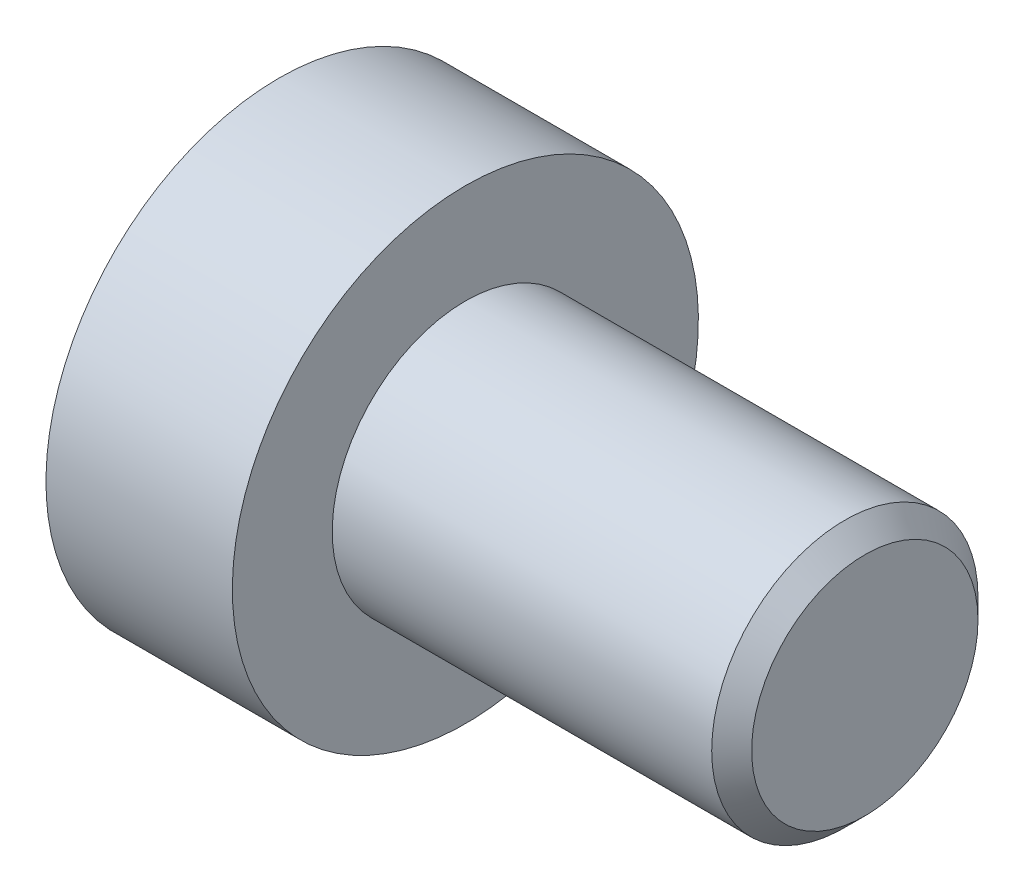
from build123d import *

# Parameters (mm, degrees)
SKETCH2_R           = 2
BOSS_EXTRUDE1_DEPTH = 6
CHAMFER1_SIZE       = 0.3
SKETCH6_W           = 2.8
SKETCH6_H           = 3.5
CUT_EXTRUDE1_DEPTH  = 1.6
SKETCH8_R           = 1.493375673
CUT_EXTRUDE2_DEPTH  = 1
CUT_EXTRUDE2_DRAFT  = -45


with BuildPart() as part:
    # Sketch2 → Boss-Extrude1 (new body)
    with BuildSketch(Plane(origin=(0, 0, 0), x_dir=(0, 0, -1), z_dir=(1, 0, 0))):
        Circle(SKETCH2_R)
    extrude(amount=-BOSS_EXTRUDE1_DEPTH)

    # Chamfer1
    chamfer1_edges = [part.edges().sort_by_distance(p)[0] for p in [
        (0, 0, 2),
    ]]
    chamfer(chamfer1_edges, length=CHAMFER1_SIZE)

    # Sketch6 → Revolve1 (revolve)
    with BuildSketch(Plane.XY):
        with Locations((-7.4, 1.75)):
            Rectangle(SKETCH6_W, SKETCH6_H)
    revolve(axis=Axis((-6, 0, 0), (-1, 0, 0)))

    # Sketch7 → Cut-Extrude1 (cut)
    with BuildSketch(Plane.ZY.offset(8.8)):
        Polygon((0, 1.443375673), (-1.25, 0.721687836), (-1.25, -0.721687836), (0, -1.443375673), (1.25, -0.721687836), (1.25, 0.721687836), align=None)
    extrude(amount=-CUT_EXTRUDE1_DEPTH, mode=Mode.SUBTRACT)


with BuildPart() as cut_extrude2_tool:
    # Sketch8 → Cut-Extrude2 (with draft: the straight prism first)
    with BuildSketch(Plane.ZY.offset(8.8)):
        Circle(SKETCH8_R)
    extrude(amount=-CUT_EXTRUDE2_DEPTH)
    # Cut-Extrude2: the draft: its side faces are tilted about the plane it starts from
    cut_extrude2_sides = [cut_extrude2_tool.faces().sort_by_distance(p)[0] for p in [
        (-8.3, 0, -1.493375673),
    ]]
    draft(cut_extrude2_sides, Plane.ZY.offset(8.8), CUT_EXTRUDE2_DRAFT)


with BuildPart() as part_1:
    add(part.part)

    # Cut-Extrude2: cut by cut_extrude2_tool
    add(cut_extrude2_tool.part, mode=Mode.SUBTRACT)


solid = part_1.part
